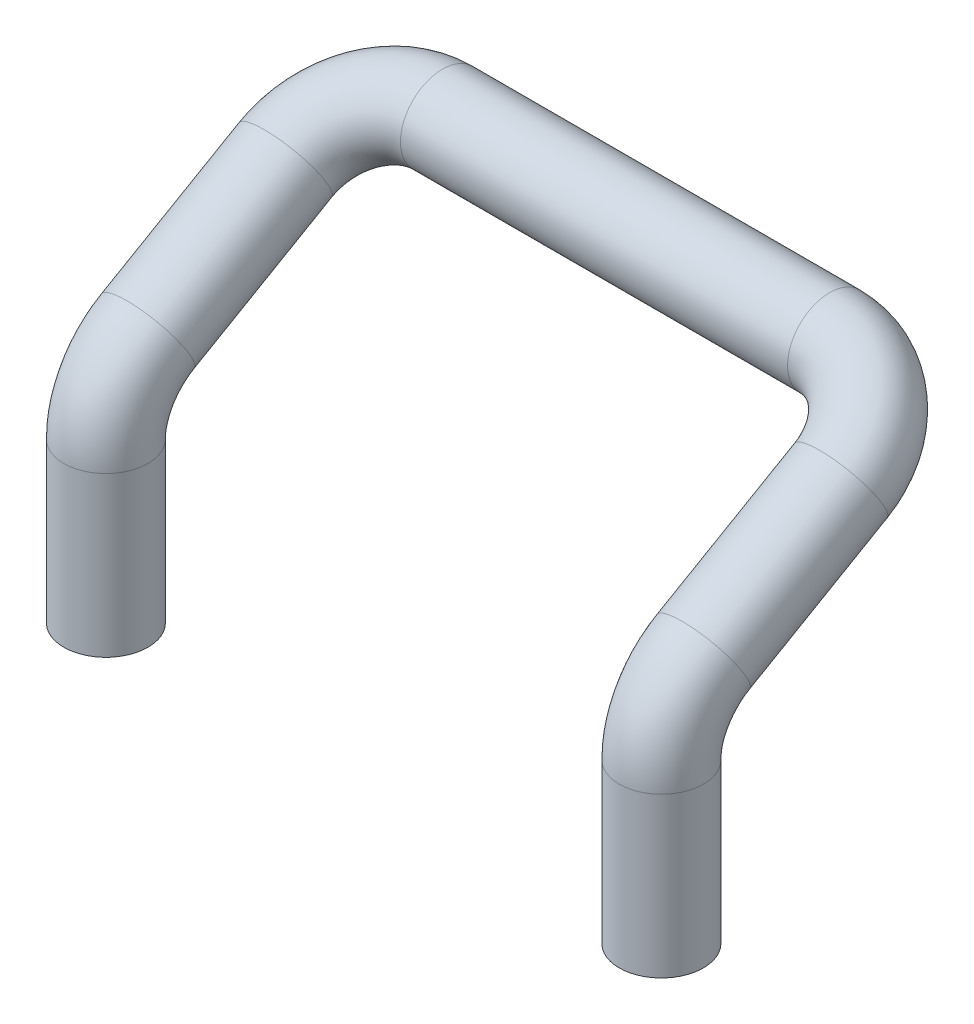
from build123d import *

# Parameters (mm, degrees)
SKETCH2_R  = 5
TAP1_D     = 4.134
TAP1_DEPTH = 15
TAP1_TIP   = 1.2419789


with BuildPart() as part:
    # Sweep1: sweep along a curve in space
    with BuildLine() as sweep1_path:
        Line((0, 0, 0), (0, 18.91, 0))
        ThreePointArc((0, 18.91, 0), (0, 23.910521052, -1.340046813), (0, 27.570855645, -5.001042158))
        Line((0, 27.570855645, -5.001042158), (0, 37.001042158, -21.339144355))
        ThreePointArc((0, 37.001042158, -21.339144355), (2.928932188, 40.535839147, -27.463294113), (10, 42, -30))
        Line((10, 42, -30), (56, 42, -30))
        ThreePointArc((66, 37.001042158, -21.339144355), (63.071067812, 40.535839147, -27.463294113), (56, 42, -30))
        Line((66, 37.001042158, -21.339144355), (66, 27.570855645, -5.001042158))
        ThreePointArc((66, 18.91, 0), (66, 23.910521052, -1.340046813), (66, 27.570855645, -5.001042158))
        Line((66, 18.91, 0), (66, 0, 0))
    # Sketch2 → Sweep1 (sweep)
    with BuildSketch(Plane(origin=(0, 0, 0), x_dir=(1, 0, 0), z_dir=(0, 1, 0))):
        Circle(SKETCH2_R)
    sweep(path=sweep1_path.line)

    # Tap1
    with Locations(Plane(origin=(0, 0, 0), x_dir=(-1, 0, 0), z_dir=(0, -1, 0))):
        with Locations((0, 0), (-66, 0)):
            Hole(TAP1_D / 2, depth=TAP1_DEPTH)
            with Locations((0, 0, -(TAP1_DEPTH + TAP1_TIP / 2))):  # 118° drill point
                Cone(0, TAP1_D / 2, TAP1_TIP, mode=Mode.SUBTRACT)


solid = part.part
